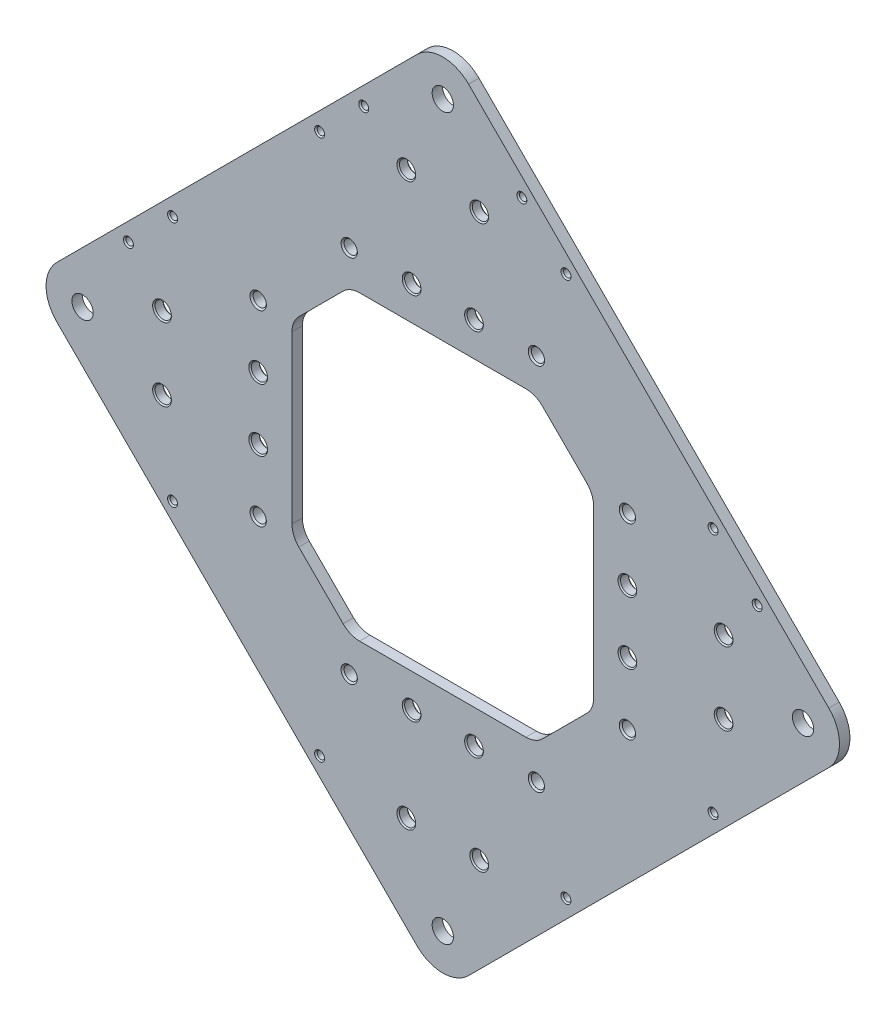
from build123d import *

# Parameters (mm, degrees)
SKETCH2_R                           = 3.2512
EXTRUDE1_DEPTH                      = 3.175
F_10_32_TAPPED_HOLE2_AT_2_COUNT     = 2
F_10_32_TAPPED_HOLE2_AT_2_PITCH     = 57.15
F_9_0_196_DIAMETER_HOLE1_AT_2_COUNT = 2
F_9_0_196_DIAMETER_HOLE1_AT_2_PITCH = 22.2504
F_9_0_196_DIAMETER_HOLE1_AT_3_COUNT = 2
F_9_0_196_DIAMETER_HOLE1_AT_3_PITCH = 35.896814536
F_9_0_196_DIAMETER_HOLE1_AT_4_COUNT = 2
F_9_0_196_DIAMETER_HOLE1_AT_4_PITCH = 29.405971737
CIRPATTERN1_COUNT                   = 4
EXTRUDE4_DEPTH                      = 172.312433006
CIRPATTERN2_COUNT                   = 4
F_4_40_TAPPED_HOLE1_AT_2_COUNT      = 2
F_4_40_TAPPED_HOLE1_AT_2_PITCH      = 87.323366189
F_4_40_TAPPED_HOLE1_AT_3_COUNT      = 2
F_4_40_TAPPED_HOLE1_AT_3_PITCH      = 63.5
CIRPATTERN3_COUNT                   = 4
F_4_40_TAPPED_HOLE2_AT_2_COUNT      = 2
F_4_40_TAPPED_HOLE2_AT_2_PITCH      = 101.6
CIRPATTERN4_COUNT                   = 2
CIRPATTERN4_ANGLE                   = 90


with BuildPart() as part:
    # Sketch2 → Extrude1 (new body)
    with BuildSketch(Plane.XY):
        with BuildLine():
            Line((117.856881333, 7.866704362), (7.866704362, 117.856881333))
            ThreePointArc((7.866704362, 117.856881333), (0, 121.115376971), (-7.866704362, 117.856881333))
            Line((-7.866704362, 117.856881333), (-117.856881333, 7.866704362))
            ThreePointArc((-117.856881333, 7.866704362), (-121.115376971, 0), (-117.856881333, -7.866704362))
            Line((-117.856881333, -7.866704362), (-7.866704362, -117.856881333))
            ThreePointArc((-7.866704362, -117.856881333), (0, -121.115376971), (7.866704362, -117.856881333))
            Line((7.866704362, -117.856881333), (117.856881333, -7.866704362))
            ThreePointArc((117.856881333, -7.866704362), (121.115376971, 0), (117.856881333, 7.866704362))
        make_face()
        with Locations((0, 109.990176971)):
            Circle(SKETCH2_R, mode=Mode.SUBTRACT)
        with Locations((-109.990176971, 0)):
            Circle(SKETCH2_R, mode=Mode.SUBTRACT)
        with Locations((0, -109.990176971)):
            Circle(SKETCH2_R, mode=Mode.SUBTRACT)
        with Locations((109.990176971, 0)):
            Circle(SKETCH2_R, mode=Mode.SUBTRACT)
    extrude(amount=-EXTRUDE1_DEPTH)

    # Sketch5 → #10-32 Tapped Hole2 (revolve, cut)
    with BuildSketch(Plane(origin=(28.575, 56.3626, 0), x_dir=(0, -1, 0), z_dir=(1, 0, 0))):
        Polygon((0, 0), (0, 14.827717848), (2.0193, 13.6144), (2.0193, 0.4699), (2.4892, 0), align=None)
    f_10_32_tapped_hole2 = revolve(axis=Axis((28.575, 56.3626, 6.35), (0, 0, -1)), mode=Mode.SUBTRACT)

    # #10-32 Tapped Hole2 at 2: #10-32 Tapped Hole2 ×2
    with Locations(*[(-i * F_10_32_TAPPED_HOLE2_AT_2_PITCH, 0, 0) for i in range(1, F_10_32_TAPPED_HOLE2_AT_2_COUNT)]):
        add(f_10_32_tapped_hole2, mode=Mode.SUBTRACT)

    # Sketch7 → #9 (0.196) Diameter Hole1 (revolve, cut)
    with BuildSketch(Plane(origin=(11.1252, 85.725, 0), x_dir=(0, -1, 0), z_dir=(1, 0, 0))):
        Polygon((0, 0), (0, 3.175), (2.8575, 3.175), (2.4892, 2.8067), (2.4892, 0.3683), (2.8575, 0), align=None)
    f_9_0_196_diameter_hole1 = revolve(axis=Axis((11.1252, 85.725, 6.35), (0, 0, -1)), mode=Mode.SUBTRACT)

    # #9 (0.196) Diameter Hole1 at 2: #9 (0.196) Diameter Hole1 ×2
    with Locations(*[(-i * F_9_0_196_DIAMETER_HOLE1_AT_2_PITCH, 0, 0) for i in range(1, F_9_0_196_DIAMETER_HOLE1_AT_2_COUNT)]):
        add(f_9_0_196_diameter_hole1, mode=Mode.SUBTRACT)

    # #9 (0.196) Diameter Hole1 at 3: #9 (0.196) Diameter Hole1 ×2
    with Locations(*[Vector(-0.5752655289105583, -0.8179667299146438, 0) * (i * F_9_0_196_DIAMETER_HOLE1_AT_3_PITCH) for i in range(1, F_9_0_196_DIAMETER_HOLE1_AT_3_COUNT)]):
        add(f_9_0_196_diameter_hole1, mode=Mode.SUBTRACT)

    # #9 (0.196) Diameter Hole1 at 4: #9 (0.196) Diameter Hole1 ×2
    with Locations(*[Vector(-0.05441751812554442, -0.998518269097294, 0) * (i * F_9_0_196_DIAMETER_HOLE1_AT_4_PITCH) for i in range(1, F_9_0_196_DIAMETER_HOLE1_AT_4_COUNT)]):
        add(f_9_0_196_diameter_hole1, mode=Mode.SUBTRACT)

    # CirPattern1: #10-32 Tapped Hole2, #9 (0.196) Diameter Hole1 ×4 about axis
    cirpattern1_axis = Axis((0, 0, 0), (0, 0, 1))
    add([f_10_32_tapped_hole2.rotate(cirpattern1_axis, i * 360 / CIRPATTERN1_COUNT) for i in range(1, CIRPATTERN1_COUNT)], mode=Mode.SUBTRACT)
    add([f_9_0_196_diameter_hole1.rotate(cirpattern1_axis, i * 360 / CIRPATTERN1_COUNT) for i in range(1, CIRPATTERN1_COUNT)], mode=Mode.SUBTRACT)

    # CirPattern1 copy 1 sketch → CirPattern1 copy 1 (revolve, cut)
    with BuildSketch(Plane(origin=(-56.3626, -28.575, 0), x_dir=(1, 0, 0), z_dir=(0, 1, 0))):
        Polygon((0, 0), (0, 14.827717848), (2.0193, 13.6144), (2.0193, 0.4699), (2.4892, 0), align=None)
    revolve(axis=Axis((-56.3626, -28.575, 6.35), (0, 0, -1)), mode=Mode.SUBTRACT)

    # CirPattern1 copy 2 sketch → CirPattern1 copy 2 (revolve, cut)
    with BuildSketch(Plane(origin=(28.575, -56.3626, 0), x_dir=(0, 1, 0), z_dir=(-1, 0, 0))):
        Polygon((0, 0), (0, 14.827717848), (2.0193, 13.6144), (2.0193, 0.4699), (2.4892, 0), align=None)
    revolve(axis=Axis((28.575, -56.3626, 6.35), (0, 0, -1)), mode=Mode.SUBTRACT)

    # CirPattern1 copy 3 sketch → CirPattern1 copy 3 (revolve, cut)
    with BuildSketch(Plane(origin=(56.3626, 28.575, 0), x_dir=(-1, 0, 0), z_dir=(0, -1, 0))):
        Polygon((0, 0), (0, 14.827717848), (2.0193, 13.6144), (2.0193, 0.4699), (2.4892, 0), align=None)
    revolve(axis=Axis((56.3626, 28.575, 6.35), (0, 0, -1)), mode=Mode.SUBTRACT)

    # CirPattern1 copy 4 sketch → CirPattern1 copy 4 (revolve, cut)
    with BuildSketch(Plane(origin=(-85.725, -11.1252, 0), x_dir=(1, 0, 0), z_dir=(0, 1, 0))):
        Polygon((0, 0), (0, 3.175), (2.8575, 3.175), (2.4892, 2.8067), (2.4892, 0.3683), (2.8575, 0), align=None)
    revolve(axis=Axis((-85.725, -11.1252, 6.35), (0, 0, -1)), mode=Mode.SUBTRACT)

    # CirPattern1 copy 5 sketch → CirPattern1 copy 5 (revolve, cut)
    with BuildSketch(Plane(origin=(11.1252, -85.725, 0), x_dir=(0, 1, 0), z_dir=(-1, 0, 0))):
        Polygon((0, 0), (0, 3.175), (2.8575, 3.175), (2.4892, 2.8067), (2.4892, 0.3683), (2.8575, 0), align=None)
    revolve(axis=Axis((11.1252, -85.725, 6.35), (0, 0, -1)), mode=Mode.SUBTRACT)

    # CirPattern1 copy 6 sketch → CirPattern1 copy 6 (revolve, cut)
    with BuildSketch(Plane(origin=(85.725, 11.1252, 0), x_dir=(-1, 0, 0), z_dir=(0, -1, 0))):
        Polygon((0, 0), (0, 3.175), (2.8575, 3.175), (2.4892, 2.8067), (2.4892, 0.3683), (2.8575, 0), align=None)
    revolve(axis=Axis((85.725, 11.1252, 6.35), (0, 0, -1)), mode=Mode.SUBTRACT)

    # CirPattern1 copy 7 sketch → CirPattern1 copy 7 (revolve, cut)
    with BuildSketch(Plane(origin=(-56.3626, -9.525, 0), x_dir=(1, 0, 0), z_dir=(0, 1, 0))):
        Polygon((0, 0), (0, 3.175), (2.8575, 3.175), (2.4892, 2.8067), (2.4892, 0.3683), (2.8575, 0), align=None)
    revolve(axis=Axis((-56.3626, -9.525, 6.35), (0, 0, -1)), mode=Mode.SUBTRACT)

    # CirPattern1 copy 8 sketch → CirPattern1 copy 8 (revolve, cut)
    with BuildSketch(Plane(origin=(9.525, -56.3626, 0), x_dir=(0, 1, 0), z_dir=(-1, 0, 0))):
        Polygon((0, 0), (0, 3.175), (2.8575, 3.175), (2.4892, 2.8067), (2.4892, 0.3683), (2.8575, 0), align=None)
    revolve(axis=Axis((9.525, -56.3626, 6.35), (0, 0, -1)), mode=Mode.SUBTRACT)

    # CirPattern1 copy 9 sketch → CirPattern1 copy 9 (revolve, cut)
    with BuildSketch(Plane(origin=(56.3626, 9.525, 0), x_dir=(-1, 0, 0), z_dir=(0, -1, 0))):
        Polygon((0, 0), (0, 3.175), (2.8575, 3.175), (2.4892, 2.8067), (2.4892, 0.3683), (2.8575, 0), align=None)
    revolve(axis=Axis((56.3626, 9.525, 6.35), (0, 0, -1)), mode=Mode.SUBTRACT)

    # CirPattern1 copy 10 sketch → CirPattern1 copy 10 (revolve, cut)
    with BuildSketch(Plane(origin=(-56.3626, 9.525, 0), x_dir=(1, 0, 0), z_dir=(0, 1, 0))):
        Polygon((0, 0), (0, 3.175), (2.8575, 3.175), (2.4892, 2.8067), (2.4892, 0.3683), (2.8575, 0), align=None)
    revolve(axis=Axis((-56.3626, 9.525, 6.35), (0, 0, -1)), mode=Mode.SUBTRACT)

    # CirPattern1 copy 11 sketch → CirPattern1 copy 11 (revolve, cut)
    with BuildSketch(Plane(origin=(-9.525, -56.3626, 0), x_dir=(0, 1, 0), z_dir=(-1, 0, 0))):
        Polygon((0, 0), (0, 3.175), (2.8575, 3.175), (2.4892, 2.8067), (2.4892, 0.3683), (2.8575, 0), align=None)
    revolve(axis=Axis((-9.525, -56.3626, 6.35), (0, 0, -1)), mode=Mode.SUBTRACT)

    # CirPattern1 copy 12 sketch → CirPattern1 copy 12 (revolve, cut)
    with BuildSketch(Plane(origin=(56.3626, -9.525, 0), x_dir=(-1, 0, 0), z_dir=(0, -1, 0))):
        Polygon((0, 0), (0, 3.175), (2.8575, 3.175), (2.4892, 2.8067), (2.4892, 0.3683), (2.8575, 0), align=None)
    revolve(axis=Axis((56.3626, -9.525, 6.35), (0, 0, -1)), mode=Mode.SUBTRACT)

    # Sketch16 → Extrude4 (cut, through all)
    with BuildSketch(Plane.XY):
        with BuildLine():
            Line((-5.08, -5.08), (46.0502, -5.08))
            Line((46.0502, -5.08), (46.0502, 25.4))
            ThreePointArc((46.0502, 25.4), (45.506897775, 28.13136473), (43.95970394, 30.44690394))
            Line((43.95970394, 30.44690394), (30.44690394, 43.95970394))
            ThreePointArc((30.44690394, 43.95970394), (28.13136473, 45.506897775), (25.4, 46.0502))
            Line((25.4, 46.0502), (-5.08, 46.0502))
            Line((-5.08, 46.0502), (-5.08, -5.08))
        make_face()
    extrude4 = extrude(amount=-EXTRUDE4_DEPTH, mode=Mode.SUBTRACT)

    # CirPattern2: Extrude4 ×4 about axis
    cirpattern2_axis = Axis((0, 0, 0), (0, 0, 1))
    for i in range(1, CIRPATTERN2_COUNT):
        add(extrude4.rotate(cirpattern2_axis, i * 360 / CIRPATTERN2_COUNT), mode=Mode.SUBTRACT)

    # Sketch20 → #4-40 Tapped Hole1 (revolve, cut)
    with BuildSketch(Plane(origin=(37.609312635, 82.51059324, 0), x_dir=(0, -1, 0), z_dir=(1, 0, 0))):
        Polygon((0, 0), (0, 3.175), (1.524, 3.175), (1.1303, 2.7813), (1.1303, 0.3937), (1.524, 0), align=None)
    f_4_40_tapped_hole1 = revolve(axis=Axis((37.609312635, 82.51059324, 6.35), (0, 0, -1)), mode=Mode.SUBTRACT)

    # #4-40 Tapped Hole1 at 2: #4-40 Tapped Hole1 ×2
    with Locations(*[Vector(-0.9515153755652143, 0.30760118670608105, 0) * (i * F_4_40_TAPPED_HOLE1_AT_2_PITCH) for i in range(1, F_4_40_TAPPED_HOLE1_AT_2_COUNT)]):
        add(f_4_40_tapped_hole1, mode=Mode.SUBTRACT)

    # #4-40 Tapped Hole1 at 3: #4-40 Tapped Hole1 ×2
    with Locations(*[Vector(0.7071067811865488, -0.7071067811865462, 0) * (i * F_4_40_TAPPED_HOLE1_AT_3_PITCH) for i in range(1, F_4_40_TAPPED_HOLE1_AT_3_COUNT)]):
        add(f_4_40_tapped_hole1, mode=Mode.SUBTRACT)

    # CirPattern3: #4-40 Tapped Hole1 ×4 about axis
    cirpattern3_axis = Axis((0, 0, 0), (0, 0, 1))
    for i in range(1, CIRPATTERN3_COUNT):
        add(f_4_40_tapped_hole1.rotate(cirpattern3_axis, i * 360 / CIRPATTERN3_COUNT), mode=Mode.SUBTRACT)

    # CirPattern3 copy 1 sketch → CirPattern3 copy 1 (revolve, cut)
    with BuildSketch(Plane(origin=(-109.371364307, -45.480212939, 0), x_dir=(1, 0, 0), z_dir=(0, 1, 0))):
        Polygon((0, 0), (0, 3.175), (1.524, 3.175), (1.1303, 2.7813), (1.1303, 0.3937), (1.524, 0), align=None)
    revolve(axis=Axis((-109.371364307, -45.480212939, 6.35), (0, 0, -1)), mode=Mode.SUBTRACT)

    # CirPattern3 copy 2 sketch → CirPattern3 copy 2 (revolve, cut)
    with BuildSketch(Plane(origin=(45.480212939, -109.371364307, 0), x_dir=(0, 1, 0), z_dir=(-1, 0, 0))):
        Polygon((0, 0), (0, 3.175), (1.524, 3.175), (1.1303, 2.7813), (1.1303, 0.3937), (1.524, 0), align=None)
    revolve(axis=Axis((45.480212939, -109.371364307, 6.35), (0, 0, -1)), mode=Mode.SUBTRACT)

    # CirPattern3 copy 3 sketch → CirPattern3 copy 3 (revolve, cut)
    with BuildSketch(Plane(origin=(109.371364307, 45.480212939, 0), x_dir=(-1, 0, 0), z_dir=(0, -1, 0))):
        Polygon((0, 0), (0, 3.175), (1.524, 3.175), (1.1303, 2.7813), (1.1303, 0.3937), (1.524, 0), align=None)
    revolve(axis=Axis((109.371364307, 45.480212939, 6.35), (0, 0, -1)), mode=Mode.SUBTRACT)

    # CirPattern3 copy 4 sketch → CirPattern3 copy 4 (revolve, cut)
    with BuildSketch(Plane(origin=(-37.609312635, 82.51059324, 0), x_dir=(1, 0, 0), z_dir=(0, 1, 0))):
        Polygon((0, 0), (0, 3.175), (1.524, 3.175), (1.1303, 2.7813), (1.1303, 0.3937), (1.524, 0), align=None)
    revolve(axis=Axis((-37.609312635, 82.51059324, 6.35), (0, 0, -1)), mode=Mode.SUBTRACT)

    # CirPattern3 copy 5 sketch → CirPattern3 copy 5 (revolve, cut)
    with BuildSketch(Plane(origin=(-82.51059324, -37.609312635, 0), x_dir=(0, 1, 0), z_dir=(-1, 0, 0))):
        Polygon((0, 0), (0, 3.175), (1.524, 3.175), (1.1303, 2.7813), (1.1303, 0.3937), (1.524, 0), align=None)
    revolve(axis=Axis((-82.51059324, -37.609312635, 6.35), (0, 0, -1)), mode=Mode.SUBTRACT)

    # CirPattern3 copy 6 sketch → CirPattern3 copy 6 (revolve, cut)
    with BuildSketch(Plane(origin=(37.609312635, -82.51059324, 0), x_dir=(-1, 0, 0), z_dir=(0, -1, 0))):
        Polygon((0, 0), (0, 3.175), (1.524, 3.175), (1.1303, 2.7813), (1.1303, 0.3937), (1.524, 0), align=None)
    revolve(axis=Axis((37.609312635, -82.51059324, 6.35), (0, 0, -1)), mode=Mode.SUBTRACT)

    # Sketch21 → #4-40 Tapped Hole2 (revolve, cut)
    with BuildSketch(Plane(origin=(24.138928453, 95.980977422, 0), x_dir=(0, -1, 0), z_dir=(1, 0, 0))):
        Polygon((0, 0), (0, 9.543752758), (1.1303, 8.8646), (1.1303, 0.3937), (1.524, 0), align=None)
    f_4_40_tapped_hole2 = revolve(axis=Axis((24.138928453, 95.980977422, 6.35), (0, 0, -1)), mode=Mode.SUBTRACT)

    # #4-40 Tapped Hole2 at 2: #4-40 Tapped Hole2 ×2
    with Locations(*[Vector(0.7071067811865476, -0.7071067811865476, 0) * (i * F_4_40_TAPPED_HOLE2_AT_2_PITCH) for i in range(1, F_4_40_TAPPED_HOLE2_AT_2_COUNT)]):
        add(f_4_40_tapped_hole2, mode=Mode.SUBTRACT)

    # CirPattern4: #4-40 Tapped Hole2 ×2 about axis
    cirpattern4_axis = Axis((0, 0, 0), (0, 0, 1))
    for i in range(1, CIRPATTERN4_COUNT):
        add(f_4_40_tapped_hole2.rotate(cirpattern4_axis, i * CIRPATTERN4_ANGLE / (CIRPATTERN4_COUNT - 1)), mode=Mode.SUBTRACT)

    # CirPattern4 copy 1 sketch → CirPattern4 copy 1 (revolve, cut)
    with BuildSketch(Plane(origin=(-24.138928453, 95.980977422, 0), x_dir=(1, 0, 0), z_dir=(0, 1, 0))):
        Polygon((0, 0), (0, 9.543752758), (1.1303, 8.8646), (1.1303, 0.3937), (1.524, 0), align=None)
    revolve(axis=Axis((-24.138928453, 95.980977422, 6.35), (0, 0, -1)), mode=Mode.SUBTRACT)


solid = part.part
